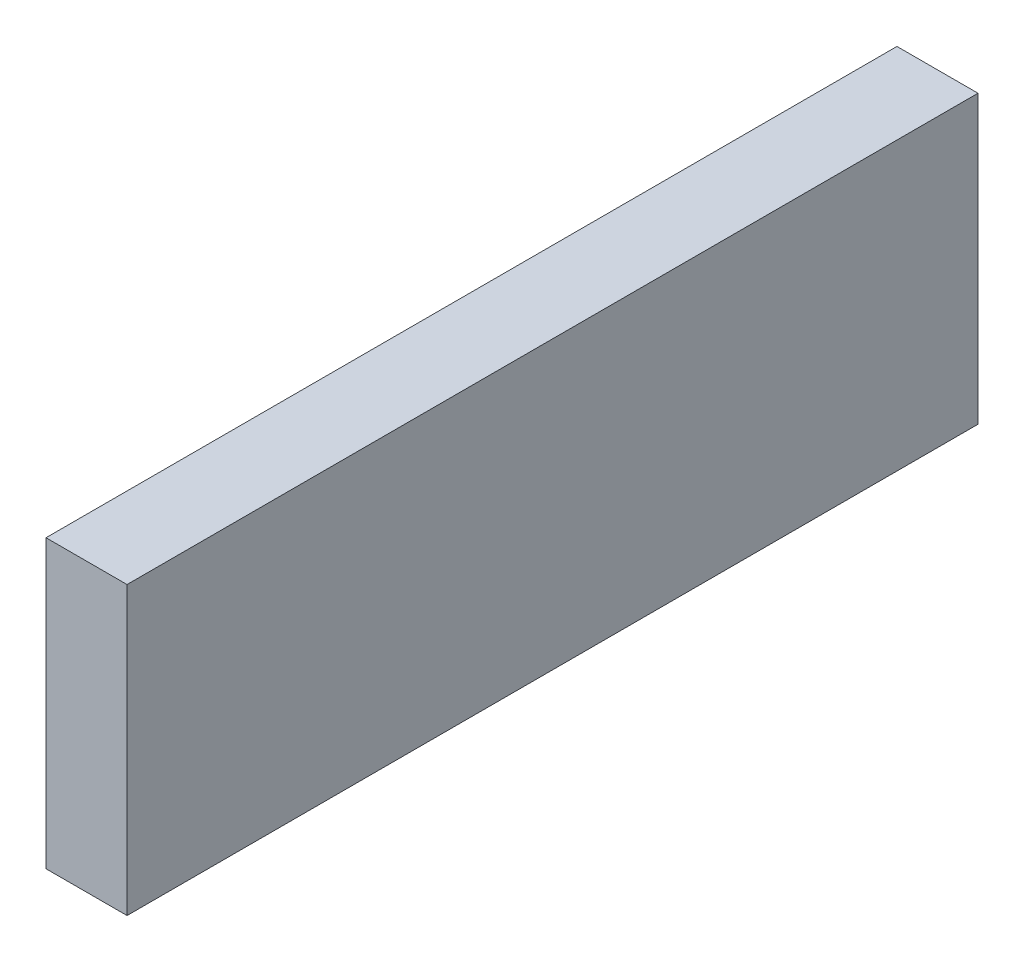
from build123d import *

# Parameters (mm, degrees)
SKETCH_1_W      = 42
SKETCH_1_H      = 14.15
EXTRUDE_1_DEPTH = 4


with BuildPart() as part:
    # Эскиз1 → Бобышка-Вытянуть1 (new body)
    with BuildSketch(Plane(origin=(0, 0, 0), x_dir=(0, 0, -1), z_dir=(1, 0, 0))):
        with Locations((21, 7.075)):
            Rectangle(SKETCH_1_W, SKETCH_1_H)
    extrude(amount=EXTRUDE_1_DEPTH)


solid = part.part
